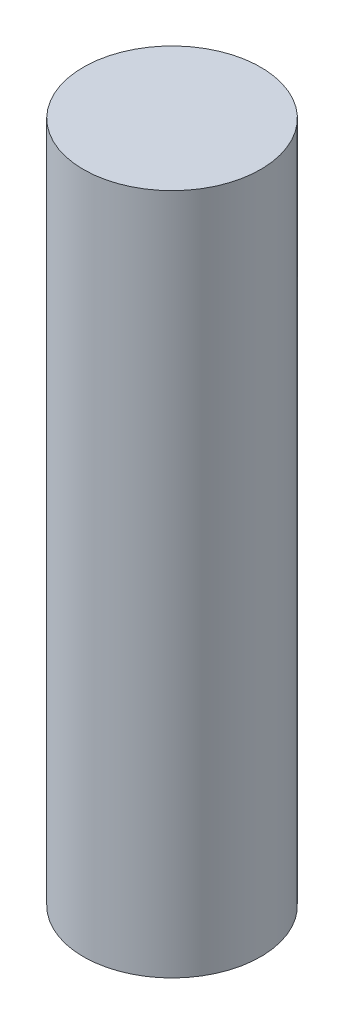
from build123d import *

# Parameters (mm, degrees)
SKETCH1_R           = 2.6
BOSS_EXTRUDE1_DEPTH = 20


with BuildPart() as part:
    # Sketch1 → Boss-Extrude1 (new body)
    with BuildSketch(Plane(origin=(0, 0, 0), x_dir=(1, 0, 0), z_dir=(0, 1, 0))):
        with Locations(Location((0, 0, 0), (0, 0, 270))):
            Circle(SKETCH1_R)
    extrude(amount=BOSS_EXTRUDE1_DEPTH)


solid = part.part
